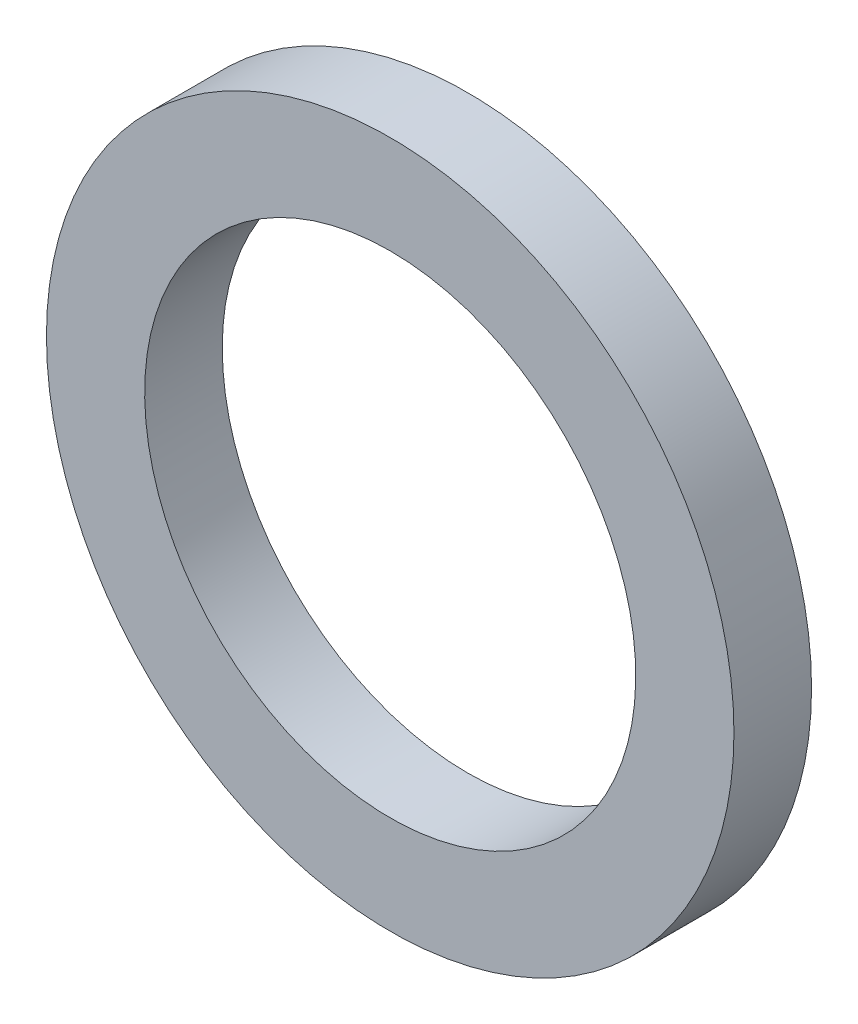
from build123d import *

# Parameters (mm, degrees)
SKETCH1_R           = 11.1125
SKETCH1_R_2         = 7.9375
BOSS_EXTRUDE1_DEPTH = 2.5080976


with BuildPart() as part:
    # Sketch1 → Boss-Extrude1 (new body)
    with BuildSketch(Plane.XY):
        with Locations(Location((0, 0, 0), (0, 0, 180))):
            Circle(SKETCH1_R)
        with Locations(Location((0, 0, 0), (0, 0, 90))):
            Circle(SKETCH1_R_2, mode=Mode.SUBTRACT)
    extrude(amount=BOSS_EXTRUDE1_DEPTH)


solid = part.part
